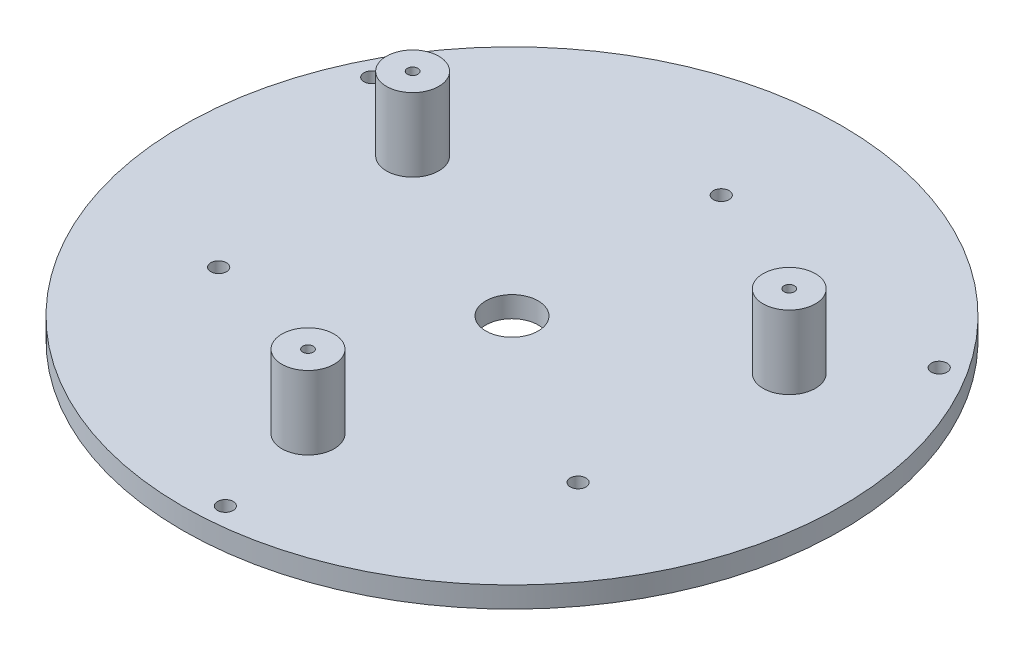
from build123d import *

# Parameters (mm, degrees)
SKETCH2_R           = 63
BOSS_EXTRUDE2_DEPTH = 4
SKETCH3_R           = 5
CUT_EXTRUDE1_DEPTH  = 4
SKETCH4_R           = 5
SKETCH4_R_2         = 1
BOSS_EXTRUDE3_DEPTH = 14
SKETCH5_R           = 1.5
CUT_EXTRUDE3_DEPTH  = 4
SKETCH7_R           = 1.5
CUT_EXTRUDE6_DEPTH  = 4


with BuildPart() as part:
    # Sketch2 → Boss-Extrude2 (new body)
    with BuildSketch(Plane(origin=(0, 0, 0), x_dir=(1, 0, 0), z_dir=(0, 1, 0))):
        with Locations(Location((0, 0, 0), (0, 0, 270))):
            Circle(SKETCH2_R)
    extrude(amount=BOSS_EXTRUDE2_DEPTH)

    # Sketch3 → Cut-Extrude1 (cut)
    with BuildSketch(Plane(origin=(0, 4, 0), x_dir=(1, 0, 0), z_dir=(0, 1, 0))):
        with Locations(Location((0, 0, 0), (0, 0, 270))):
            Circle(SKETCH3_R)
    extrude(amount=-CUT_EXTRUDE1_DEPTH, mode=Mode.SUBTRACT)

    # Sketch4 → Boss-Extrude3 (add)
    # profile 1 of 3: a face of its own
    with BuildSketch(Plane(origin=(0, 4, 0), x_dir=(1, 0, 0), z_dir=(0, 1, 0))):
        with Locations(Location((-36, 17, 0), (0, 0, 90))):
            Circle(SKETCH4_R)
        with Locations(Location((-36, 17, 0), (0, 0, 90))):
            Circle(SKETCH4_R_2, mode=Mode.SUBTRACT)
    # profile 2 of 3: a face of its own
    with BuildSketch(Plane(origin=(0, 4, 0), x_dir=(1, 0, 0), z_dir=(0, 1, 0))):
        with Locations(Location((36, 17, 0), (0, 0, 90))):
            Circle(SKETCH4_R)
        with Locations(Location((36, 17, 0), (0, 0, 90))):
            Circle(SKETCH4_R_2, mode=Mode.SUBTRACT)
    # profile 3 of 3: a face of its own
    with BuildSketch(Plane(origin=(0, 4, 0), x_dir=(1, 0, 0), z_dir=(0, 1, 0))):
        with Locations(Location((0, -39, 0), (0, 0, 90))):
            Circle(SKETCH4_R)
        with Locations(Location((0, -39, 0), (0, 0, 90))):
            Circle(SKETCH4_R_2, mode=Mode.SUBTRACT)
    extrude(amount=BOSS_EXTRUDE3_DEPTH)

    # Sketch5 → Cut-Extrude3 (cut)
    with BuildSketch(Plane(origin=(0, 4, 0), x_dir=(1, 0, 0), z_dir=(0, 1, 0))):
        with Locations(Location((33.888604279, -21.25, 0), (0, 0, 270))):
            Circle(SKETCH5_R)
        with Locations(Location((-36.099753842, -19.973392205, 0), (0, 0, 270))):
            Circle(SKETCH5_R)
        with Locations(Location((0, 40, 0), (0, 0, 270))):
            Circle(SKETCH5_R)
    extrude(amount=-CUT_EXTRUDE3_DEPTH, mode=Mode.SUBTRACT)

    # Sketch7 → Cut-Extrude6 (cut)
    with BuildSketch(Plane.XZ):
        with Locations(Location((4.063188835, 58.859922668, 0), (0, 0, 270))):
            Circle(SKETCH7_R)
        with Locations(Location((-52.909524673, -26.107129273, 0), (0, 0, 270))):
            Circle(SKETCH7_R)
        with Locations(Location((49.390475327, -32.273533227, 0), (0, 0, 270))):
            Circle(SKETCH7_R)
    extrude(amount=-CUT_EXTRUDE6_DEPTH, mode=Mode.SUBTRACT)


solid = part.part
